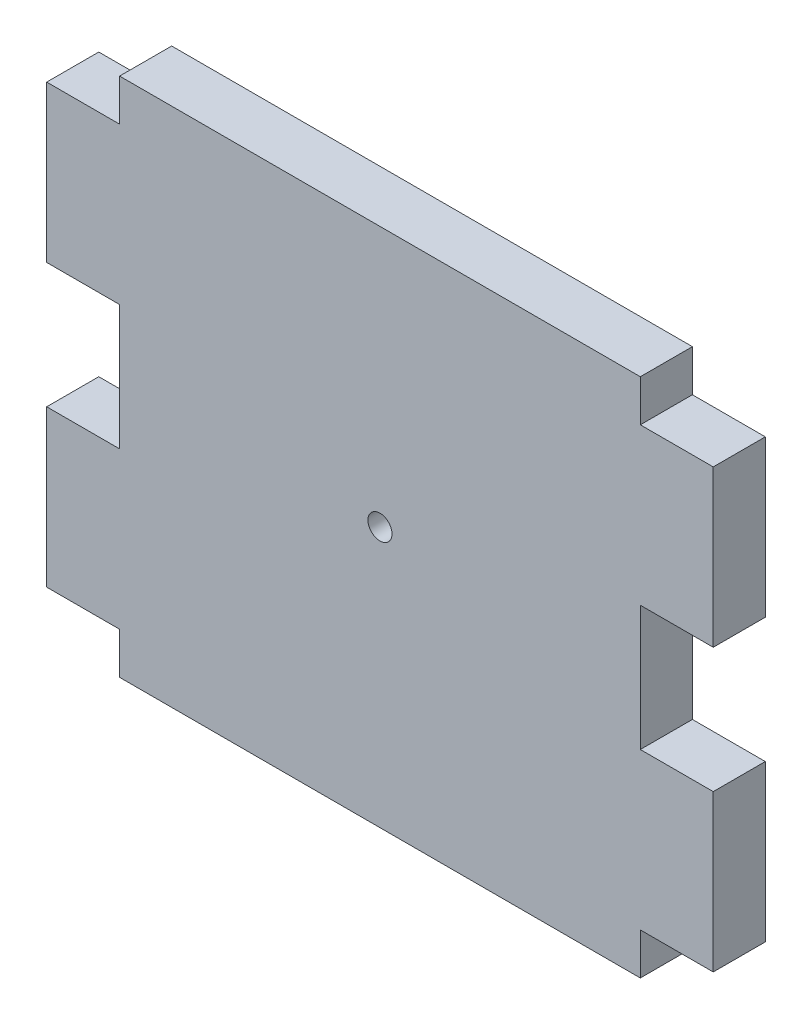
from build123d import *

# Parameters (mm, degrees)
BOSS_EXTRUDE1_DEPTH = 5
SKETCH2_R           = 1.155281189
CUT_EXTRUDE1_DEPTH  = 10


with BuildPart() as part:
    # Sketch1 → Boss-Extrude1 (new body)
    with BuildSketch(Plane.XY):
        Polygon((0, 0), (50, 0), (50, -4), (57, -4), (57, -19), (50, -19), (50, -31), (57, -31), (57, -46), (50, -46), (50, -50), (0, -50), (0, -46), (-7, -46), (-7, -31), (0, -31), (0, -19), (-7, -19), (-7, -4), (0, -4), align=None)
    extrude(amount=BOSS_EXTRUDE1_DEPTH)

    # Sketch2 → Cut-Extrude1 (cut)
    with BuildSketch(Plane.XY.offset(5)):
        with Locations((25, -25)):
            Circle(SKETCH2_R)
    extrude(amount=-CUT_EXTRUDE1_DEPTH, mode=Mode.SUBTRACT)


solid = part.part
